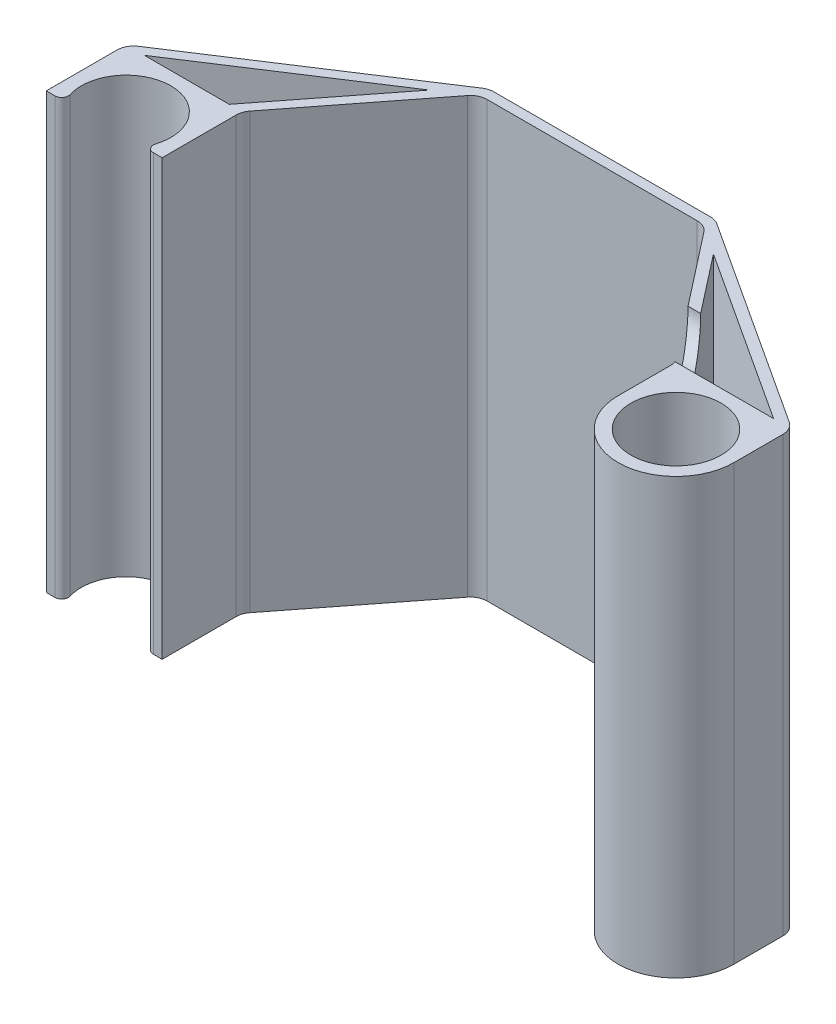
from build123d import *

# Parameters (mm, degrees)
BOSS_EXTRUDE1_DEPTH            = 130.5
SKETCH4_W                      = 34.8
SKETCH4_H                      = 34.8
SKETCH4_R                      = 13.45
BOSS_EXTRUDE2_DEPTH            = 130.5
FILLET1_R                      = 5
CUT_EXTRUDE4_DEPTH             = 182.887575167
CUT_EXTRUDE5_REACH             = 226.442
SKETCH7_R                      = 8.2
CUT_EXTRUDE5_DIRECTION_2_REACH = 226.442
SKETCH8_R                      = 13.55
CUT_EXTRUDE6_DEPTH             = 182.887575238


with BuildPart() as part:
    # Sketch1 → Boss-Extrude1 (new body)
    with BuildSketch(Plane(origin=(0, 0, 0), x_dir=(1, 0, 0), z_dir=(0, 1, 0))):
        with BuildLine():
            Line((0, 0), (-34, 0))
            Line((-34, 0), (-100, -43))
            Line((-100, -43), (-100, -66.97))
            Line((-100, -66.97), (-97.358644924, -66.97))
            ThreePointArc((-97.358644924, -66.97), (-95.748804634, -66.156766295), (-95.448140727, -64.378414239))
            ThreePointArc((-95.448140727, -64.378414239), (-82.6, -46.95), (-69.751859273, -64.378414239))
            ThreePointArc((-69.751859273, -64.378414239), (-69.451195366, -66.156766295), (-67.841355076, -66.97))
            Line((-67.841355076, -66.97), (-65.2, -66.97))
            Line((-65.2, -66.97), (-65.2, -43))
            Line((-65.2, -43), (-34, -3))
            Line((-34, -3), (0, -3))
            Line((0, -3), (0, 0))
        make_face()
        Polygon((-69.004681327, -43), (-94.504291462, -43), (-42.656655328, -9.220479488), align=None, mode=Mode.SUBTRACT)
    boss_extrude1 = extrude(amount=BOSS_EXTRUDE1_DEPTH)

    # Mirror1: Boss-Extrude1 across plane
    add(boss_extrude1.mirror(Plane(origin=(0, 130.5, 3), x_dir=(0, 0, 1), z_dir=(-1, 0, 0))))

    # Sketch4 → Boss-Extrude2 (add)
    with BuildSketch(Plane.XZ):
        with Locations((82.6, 60.4)):
            Rectangle(SKETCH4_W, SKETCH4_H)
        with Locations(Location((82.6, 60.4, 0), (0, 0, 270))):
            Circle(SKETCH4_R, mode=Mode.SUBTRACT)
    extrude(amount=-BOSS_EXTRUDE2_DEPTH)

    # Fillet1
    fillet1_edges = [part.edges().sort_by_distance(p)[0] for p in [
        (-34, 65.25, 3),
        (-65.2, 65.25, 43),
        (-100, 65.25, 43),
        (-34, 65.25, 0),
        (34, 65.25, 3),
        (65.2, 65.25, 43),
        (100, 65.25, 43),
        (34, 65.25, 0),
    ]]
    fillet(fillet1_edges, radius=FILLET1_R)

    # Sketch5 → Cut-Extrude4 (cut, through all)
    with BuildSketch(Plane.XZ):
        with BuildLine():
            Line((65.2, 60.4), (65.2, 77.8))
            Line((65.2, 77.8), (83.070170915, 82.404410021))
            Line((83.070170915, 82.404410021), (100, 77.8))
            Line((100, 77.8), (100, 60.4))
            ThreePointArc((100, 60.4), (82.6, 77.8), (65.2, 60.4))
        make_face()
    extrude(amount=-CUT_EXTRUDE4_DEPTH, mode=Mode.SUBTRACT)

    # Sketch7 → Cut-Extrude5 (cut, up to next)
    with BuildSketch(Plane.ZY.offset(-65.2), mode=Mode.PRIVATE) as cut_extrude5_sk1:
        with Locations((34.8, 0)):
            Circle(SKETCH7_R)
    cut_extrude5_tool1 = extrude(cut_extrude5_sk1.sketch, amount=-CUT_EXTRUDE5_REACH, mode=Mode.PRIVATE) & part.part
    # Sketch7 → Cut-Extrude5 (cut, up to next)
    with BuildSketch(Plane.ZY.offset(-65.2), mode=Mode.PRIVATE) as cut_extrude5_sk2:
        with Locations((34.8, 130.5)):
            Circle(SKETCH7_R)
    cut_extrude5_tool2 = extrude(cut_extrude5_sk2.sketch, amount=-CUT_EXTRUDE5_REACH, mode=Mode.PRIVATE) & part.part
    add(cut_extrude5_tool1.solids().sort_by_distance((65.2, 0, 34.8))[0], mode=Mode.SUBTRACT)
    add(cut_extrude5_tool2.solids().sort_by_distance((65.2, 130.5, 34.8))[0], mode=Mode.SUBTRACT)

    # Sketch7 → Cut-Extrude5 direction 2 (cut, up to next)
    with BuildSketch(Plane.ZY.offset(-65.2), mode=Mode.PRIVATE) as cut_extrude5_direction_2_sk1:
        with Locations((34.8, 0)):
            Circle(SKETCH7_R)
    cut_extrude5_direction_2_tool1 = extrude(cut_extrude5_direction_2_sk1.sketch, amount=CUT_EXTRUDE5_DIRECTION_2_REACH, mode=Mode.PRIVATE) & part.part
    # Sketch7 → Cut-Extrude5 direction 2 (cut, up to next)
    with BuildSketch(Plane.ZY.offset(-65.2), mode=Mode.PRIVATE) as cut_extrude5_direction_2_sk2:
        with Locations((34.8, 130.5)):
            Circle(SKETCH7_R)
    cut_extrude5_direction_2_tool2 = extrude(cut_extrude5_direction_2_sk2.sketch, amount=CUT_EXTRUDE5_DIRECTION_2_REACH, mode=Mode.PRIVATE) & part.part
    add(cut_extrude5_direction_2_tool1.solids().sort_by_distance((65.2, 0, 34.8))[0], mode=Mode.SUBTRACT)
    add(cut_extrude5_direction_2_tool2.solids().sort_by_distance((65.2, 130.5, 34.8))[0], mode=Mode.SUBTRACT)

    # Sketch8 → Cut-Extrude6 (cut, through all)
    with BuildSketch(Plane.XZ):
        with Locations(Location((82.6, 60.4, 0), (0, 0, 270))):
            Circle(SKETCH8_R)
    extrude(amount=-CUT_EXTRUDE6_DEPTH, mode=Mode.SUBTRACT)


solid = part.part
